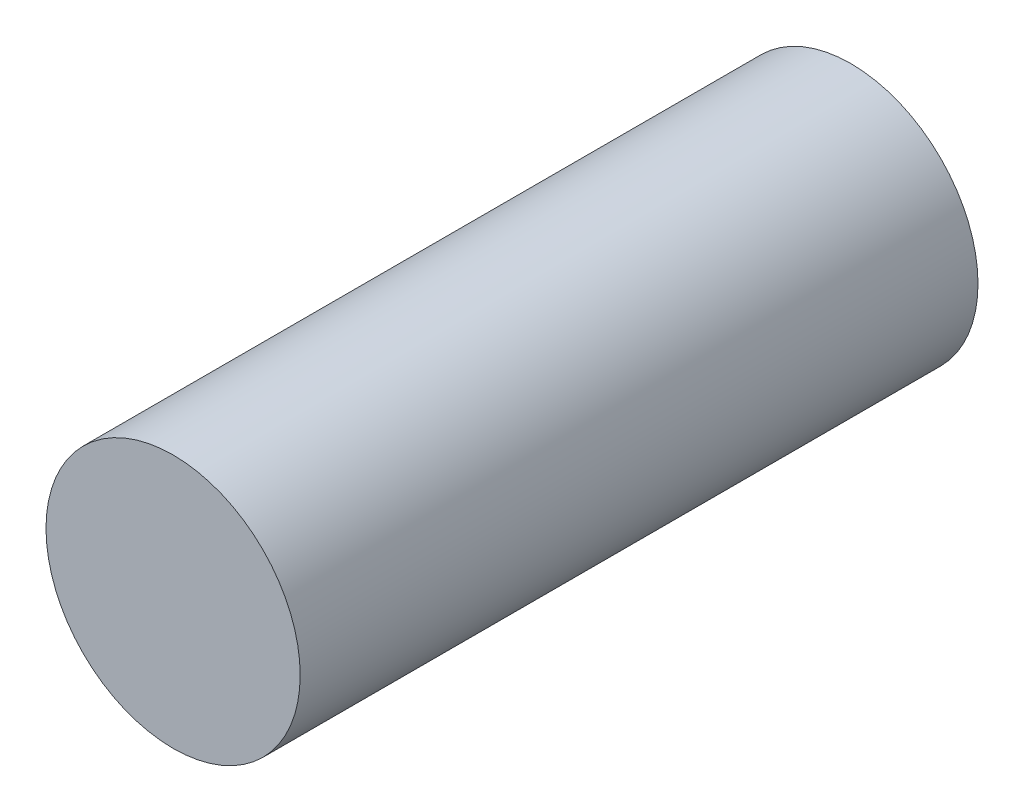
from build123d import *

# Parameters (mm, degrees)
SKETCH1_R      = 3
ENVELOPE_DEPTH = 16


with BuildPart() as part:
    # Sketch1 → Envelope (new body)
    with BuildSketch(Plane.XY):
        Circle(SKETCH1_R)
    extrude(amount=ENVELOPE_DEPTH)


solid = part.part
